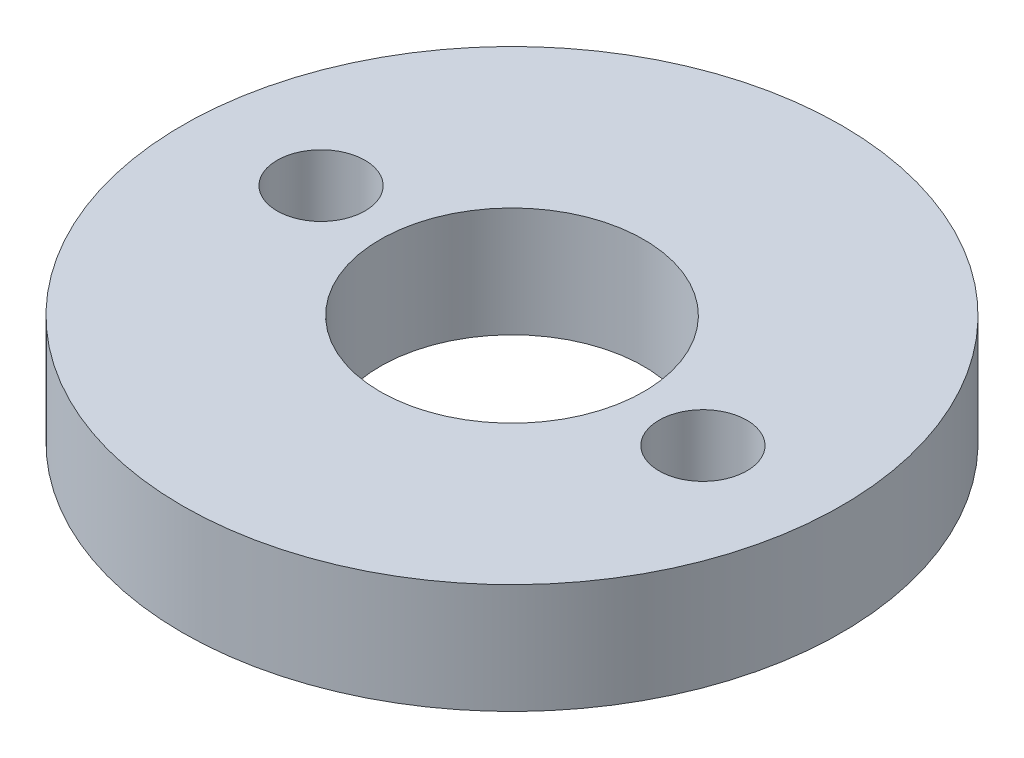
from build123d import *

# Parameters (mm, degrees)
SKETCH1_R           = 15
SKETCH1_R_2         = 6
BOSS_EXTRUDE1_DEPTH = 5
SKETCH2_R           = 2
CUT_EXTRUDE1_DEPTH  = 22.794494718


with BuildPart() as part:
    # Sketch1 → Boss-Extrude1 (new body)
    with BuildSketch(Plane(origin=(0, 0, 0), x_dir=(1, 0, 0), z_dir=(0, 1, 0))):
        with Locations(Location((0, 0, 0), (0, 0, 270))):
            Circle(SKETCH1_R)
        with Locations(Location((0, 0, 0), (0, 0, 270))):
            Circle(SKETCH1_R_2, mode=Mode.SUBTRACT)
    extrude(amount=BOSS_EXTRUDE1_DEPTH)

    # Sketch2 → Cut-Extrude1 (cut, through all)
    with BuildSketch(Plane.XZ):
        with Locations(Location((-9.468140802, -0.77737362, 0), (0, 0, 270))):
            Circle(SKETCH2_R)
        with Locations(Location((9.468140802, 0.77737362, 0), (0, 0, 270))):
            Circle(SKETCH2_R)
    extrude(amount=-CUT_EXTRUDE1_DEPTH, mode=Mode.SUBTRACT)


solid = part.part
